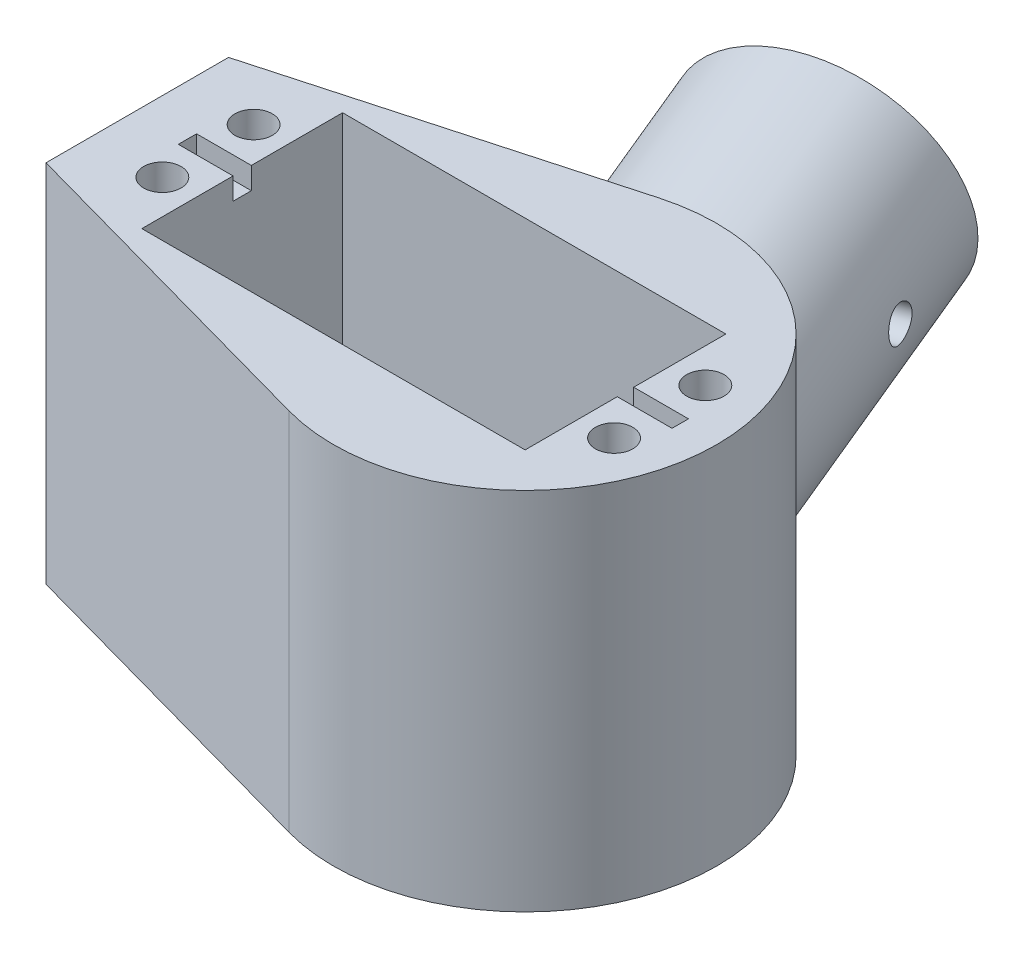
from build123d import *

# Parameters (mm, degrees)
SKETCH1_R           = 6
BOSS_EXTRUDE1_DEPTH = 40
SKETCH2_W           = 42
SKETCH2_H           = 22
CUT_EXTRUDE1_DEPTH  = 25
SKETCH3_R           = 2.05
CUT_EXTRUDE2_DEPTH  = 12
SKETCH4_R           = 9.55
CUT_EXTRUDE3_DEPTH  = 5
CUT_EXTRUDE4_START  = -6
SKETCH5_R           = 9.55
CUT_EXTRUDE4_DEPTH  = 6
SKETCH7_W           = 6
SKETCH7_H           = 2
SKETCH7_H_2         = 1.8
CUT_EXTRUDE5_DEPTH  = 2.4
BOSS_EXTRUDE3_REACH = 85.871
SKETCH10_R          = 13.5
SKETCH10_R_2        = 10
BOSS_EXTRUDE4_REACH = 69.699
SKETCH11_R          = 10
SKETCH15_R          = 1.85
CUT_EXTRUDE8_DEPTH  = 13.5


with BuildPart() as part:
    # Sketch1 → Boss-Extrude1 (new body)
    with BuildSketch(Plane(origin=(0, 0, 0), x_dir=(1, 0, 0), z_dir=(0, 1, 0))):
        with BuildLine():
            Line((-42.5, -10), (-5.61521172, -20.235350191))
            ThreePointArc((-5.61521172, -20.235350191), (21, 0), (-5.61521172, 20.235350191))
            Line((-5.61521172, 20.235350191), (-42.5, 10))
            Line((-42.5, 10), (-42.5, -10))
        make_face()
        Circle(SKETCH1_R, mode=Mode.SUBTRACT)
    extrude(amount=BOSS_EXTRUDE1_DEPTH)

    # Sketch2 → Cut-Extrude1 (cut)
    with BuildSketch(Plane(origin=(0, 40, 0), x_dir=(1, 0, 0), z_dir=(0, 1, 0))):
        with Locations((-10, 0)):
            Rectangle(SKETCH2_W, SKETCH2_H)
    extrude(amount=-CUT_EXTRUDE1_DEPTH, mode=Mode.SUBTRACT)

    # Sketch3 → Cut-Extrude2 (cut)
    with BuildSketch(Plane(origin=(0, 40, 0), x_dir=(1, 0, 0), z_dir=(0, 1, 0))):
        with Locations((14.75, 5)):
            Circle(SKETCH3_R)
        with Locations((14.75, -5)):
            Circle(SKETCH3_R)
        with Locations((-34.75, 5)):
            Circle(SKETCH3_R)
        with Locations((-34.75, -5)):
            Circle(SKETCH3_R)
    extrude(amount=-CUT_EXTRUDE2_DEPTH, mode=Mode.SUBTRACT)

    # Sketch4 → Cut-Extrude3 (cut)
    with BuildSketch(Plane(origin=(0, 15, 0), x_dir=(1, 0, 0), z_dir=(0, 1, 0))):
        Circle(SKETCH4_R)
    extrude(amount=-CUT_EXTRUDE3_DEPTH, mode=Mode.SUBTRACT)

    # Sketch5 → Cut-Extrude4 (cut)
    with BuildSketch(Plane.XZ.offset(CUT_EXTRUDE4_START)):
        Circle(SKETCH5_R)
    extrude(amount=CUT_EXTRUDE4_DEPTH, mode=Mode.SUBTRACT)

    # Sketch7 → Cut-Extrude5 (cut)
    with BuildSketch(Plane(origin=(0, 40, 0), x_dir=(1, 0, 0), z_dir=(0, 1, 0))):
        with Locations((-34, 0)):
            Rectangle(SKETCH7_W, SKETCH7_H)
        with Locations((14, 0)):
            Rectangle(SKETCH7_W, SKETCH7_H_2)
    extrude(amount=-CUT_EXTRUDE5_DEPTH, mode=Mode.SUBTRACT)

    # Sketch10 → Boss-Extrude3 (add, up to next)
    with BuildSketch(Plane(origin=(-14.44792881, 9.795327955, -48.752531942), x_dir=(-0.1684900846658349, 0.9555547539512137, 0.24192189559966493), z_dir=(0.2790079990820694, -0.18916032111653794, 0.9414737964294643)), mode=Mode.PRIVATE) as boss_extrude3_sk1:
        with Locations((15.161828301, -3.96392858)):
            Circle(SKETCH10_R)
        with Locations((15.161828301, -3.96392858)):
            Circle(SKETCH10_R_2, mode=Mode.SUBTRACT)
    boss_extrude3_tool1 = extrude(boss_extrude3_sk1.sketch, amount=BOSS_EXTRUDE3_REACH, mode=Mode.PRIVATE) - part.part
    add(boss_extrude3_tool1.solids().sort_by_distance((-11.044801, 12.644515, -49.1886))[0])

    # Sketch11 → Boss-Extrude4 (add, up to next)
    with BuildSketch(Plane(origin=(-7.472728833, 5.066319927, -25.215687031), x_dir=(-0.9602887776331763, -0.054959762031716174, 0.273541382809251), z_dir=(-0.27900799908206947, 0.189160321116538, -0.9414737964294642)), mode=Mode.PRIVATE) as boss_extrude4_sk1:
        with Locations((-1.242176115, 15.622124238)):
            Circle(SKETCH11_R)
    boss_extrude4_tool1 = extrude(boss_extrude4_sk1.sketch, amount=-BOSS_EXTRUDE4_REACH, mode=Mode.PRIVATE) - part.part
    add(boss_extrude4_tool1.solids().sort_by_distance((-6.279881, 20.450629, -22.478185))[0])

    # Sketch15 → Cut-Extrude8 (cut, symmetric)
    with BuildSketch(Plane(origin=(1.192847783, 0.068269704, -0.339786572), x_dir=(-0.27900799908206936, 0.18916032111653794, -0.9414737964294643), z_dir=(-0.9602887776331764, -0.054959762031716174, 0.2735413828092509))):
        with Locations((39.283206422, -15.622124238)):
            Circle(SKETCH15_R)
    extrude(amount=CUT_EXTRUDE8_DEPTH, both=True, mode=Mode.SUBTRACT)


solid = part.part
